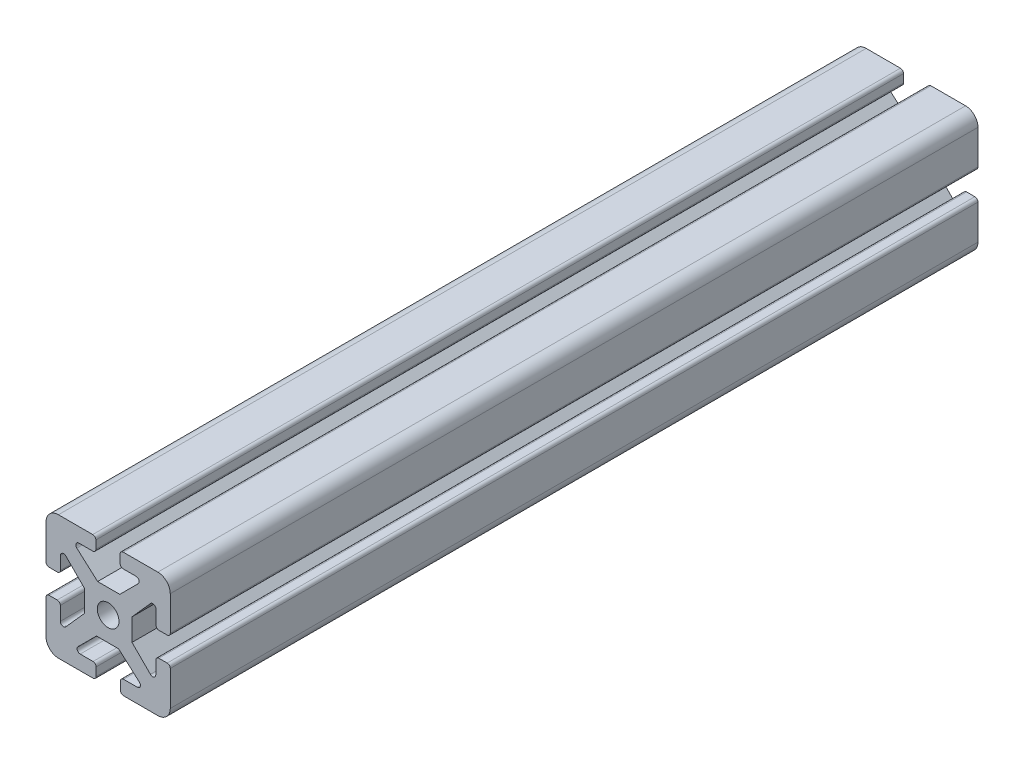
from build123d import *

# Parameters (mm, degrees)
SKETCH2_R           = 3.492543695
BOSS_EXTRUDE1_DEPTH = 260


with BuildPart() as part:
    # Sketch2 → Boss-Extrude1 (new body)
    with BuildSketch(Plane.XY):
        with BuildLine():
            Line((19.48831917, 27.684671829), (23.749889801, 27.684671829))
            Line((23.749889801, 27.684671829), (29.699681879, 33.624984685))
            ThreePointArc((29.699681879, 33.624984685), (29.917171057, 34.714970099), (28.993139054, 35.332654972))
            Line((28.993139054, 35.332654972), (24.845630957, 35.332654972))
            ThreePointArc((24.845630957, 35.332654972), (24.138524175, 35.625548191), (23.845630957, 36.332654972))
            Line((23.845630957, 36.332654972), (23.845630957, 39))
            ThreePointArc((23.845630957, 39), (24.138524175, 39.707106781), (24.845630957, 40))
            Line((24.845630957, 40), (36, 40))
            ThreePointArc((36, 40), (38.828427125, 38.828427125), (40, 36))
            Line((40, 36), (40, 24.961087436))
            ThreePointArc((40, 24.961087436), (39.707106781, 24.253980655), (39, 23.961087436))
            Line((39, 23.961087436), (36.388269628, 23.961087436))
            ThreePointArc((36.388269628, 23.961087436), (35.681162846, 24.253980655), (35.388269628, 24.961087436))
            Line((35.388269628, 24.961087436), (35.388269628, 29.408620307))
            ThreePointArc((35.388269628, 29.408620307), (34.744223919, 30.343123673), (33.641676542, 30.073901274))
            Line((33.641676542, 30.073901274), (27.684671829, 23.388818206))
            Line((27.684671829, 23.388818206), (27.684671829, 20.51168083))
            Line((27.684671829, 20.51168083), (27.684671829, 16.250110199))
            Line((27.684671829, 16.250110199), (33.624984685, 10.300318121))
            ThreePointArc((33.624984685, 10.300318121), (34.714970099, 10.082828943), (35.332654972, 11.006860946))
            Line((35.332654972, 11.006860946), (35.332654972, 15.154369043))
            ThreePointArc((35.332654972, 15.154369043), (35.625548191, 15.861475825), (36.332654972, 16.154369043))
            Line((36.332654972, 16.154369043), (39, 16.154369043))
            ThreePointArc((39, 16.154369043), (39.707106781, 15.861475825), (40, 15.154369043))
            Line((40, 15.154369043), (40, 4))
            ThreePointArc((40, 4), (38.828427125, 1.171572875), (36, 0))
            Line((36, 0), (24.961087436, 0))
            ThreePointArc((24.961087436, 0), (24.253980655, 0.292893219), (23.961087436, 1))
            Line((23.961087436, 1), (23.961087436, 3.611730372))
            ThreePointArc((23.961087436, 3.611730372), (24.253980655, 4.318837154), (24.961087436, 4.611730372))
            Line((24.961087436, 4.611730372), (29.408620307, 4.611730372))
            ThreePointArc((29.408620307, 4.611730372), (30.343123673, 5.255776081), (30.073901274, 6.358323458))
            Line((30.073901274, 6.358323458), (23.388818206, 12.315328171))
            Line((23.388818206, 12.315328171), (20.51168083, 12.315328171))
            Line((20.51168083, 12.315328171), (16.250110199, 12.315328171))
            Line((16.250110199, 12.315328171), (10.300318121, 6.375015315))
            ThreePointArc((10.300318121, 6.375015315), (10.082828943, 5.285029901), (11.006860946, 4.667345028))
            Line((11.006860946, 4.667345028), (15.154369043, 4.667345028))
            ThreePointArc((15.154369043, 4.667345028), (15.861475825, 4.374451809), (16.154369043, 3.667345028))
            Line((16.154369043, 3.667345028), (16.154369043, 1))
            ThreePointArc((16.154369043, 1), (15.861475825, 0.292893219), (15.154369043, 0))
            Line((15.154369043, 0), (4, 0))
            ThreePointArc((4, 0), (1.171572875, 1.171572875), (0, 4))
            Line((0, 4), (0, 15.038912564))
            ThreePointArc((0, 15.038912564), (0.292893219, 15.746019345), (1, 16.038912564))
            Line((1, 16.038912564), (3.611730372, 16.038912564))
            ThreePointArc((3.611730372, 16.038912564), (4.318837154, 15.746019345), (4.611730372, 15.038912564))
            Line((4.611730372, 15.038912564), (4.611730372, 10.591379693))
            ThreePointArc((4.611730372, 10.591379693), (5.255776081, 9.656876327), (6.358323458, 9.926098726))
            Line((6.358323458, 9.926098726), (12.315328171, 16.611181794))
            Line((12.315328171, 16.611181794), (12.315328171, 19.48831917))
            Line((12.315328171, 19.48831917), (12.315328171, 23.749889801))
            Line((12.315328171, 23.749889801), (6.375015315, 29.699681879))
            ThreePointArc((6.375015315, 29.699681879), (5.285029901, 29.917171057), (4.667345028, 28.993139054))
            Line((4.667345028, 28.993139054), (4.667345028, 24.845630957))
            ThreePointArc((4.667345028, 24.845630957), (4.374451809, 24.138524175), (3.667345028, 23.845630957))
            Line((3.667345028, 23.845630957), (1, 23.845630957))
            ThreePointArc((1, 23.845630957), (0.292893219, 24.138524175), (0, 24.845630957))
            Line((0, 24.845630957), (0, 36))
            ThreePointArc((0, 36), (1.171572875, 38.828427125), (4, 40))
            Line((4, 40), (15.038912564, 40))
            ThreePointArc((15.038912564, 40), (15.746019345, 39.707106781), (16.038912564, 39))
            Line((16.038912564, 39), (16.038912564, 36.388269628))
            ThreePointArc((16.038912564, 36.388269628), (15.746019345, 35.681162846), (15.038912564, 35.388269628))
            Line((15.038912564, 35.388269628), (10.591379693, 35.388269628))
            ThreePointArc((10.591379693, 35.388269628), (9.656876327, 34.744223919), (9.926098726, 33.641676542))
            Line((9.926098726, 33.641676542), (16.611181794, 27.684671829))
            Line((16.611181794, 27.684671829), (19.48831917, 27.684671829))
        make_face()
        with Locations((20, 20)):
            Circle(SKETCH2_R, mode=Mode.SUBTRACT)
    extrude(amount=BOSS_EXTRUDE1_DEPTH)


solid = part.part
